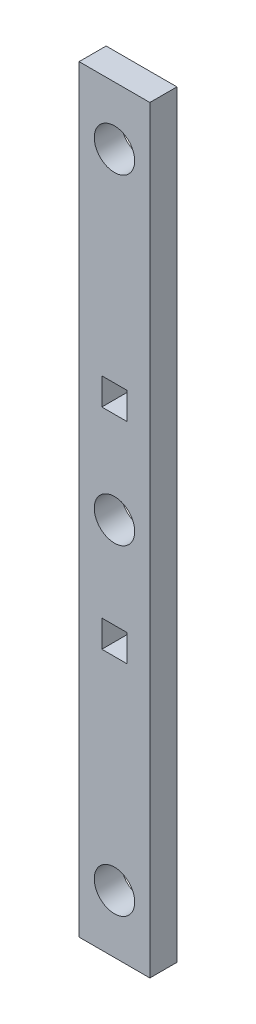
from build123d import *

# Parameters (mm, degrees)
MODEL_W             = 14.000000432
MODEL_H             = 150.00000596
MODEL_R             = 4
MODEL_W_2           = 4.999999888
MODEL_H_2           = 5.349999294
BOSS_EXTRUDE1_DEPTH = 5.35


with BuildPart() as part:
    # Model → Boss-Extrude1 (new body)
    with BuildSketch(Plane.XY):
        with Locations((7.000000216, 75.00000298)):
            Rectangle(MODEL_W, MODEL_H)
        with Locations((7.000000216, 75.00000298)):
            Circle(MODEL_R, mode=Mode.SUBTRACT)
        with Locations((7.000000216, 11.50000298)):
            Circle(MODEL_R, mode=Mode.SUBTRACT)
        with Locations((7.000000216, 138.50000298)):
            Circle(MODEL_R, mode=Mode.SUBTRACT)
        with Locations((7.000000216, 54.250002839)):
            Rectangle(MODEL_W_2, MODEL_H_2, mode=Mode.SUBTRACT)
        with Locations((7.000000216, 95.750003122)):
            Rectangle(MODEL_W_2, MODEL_H_2, mode=Mode.SUBTRACT)
    extrude(amount=BOSS_EXTRUDE1_DEPTH)


solid = part.part
